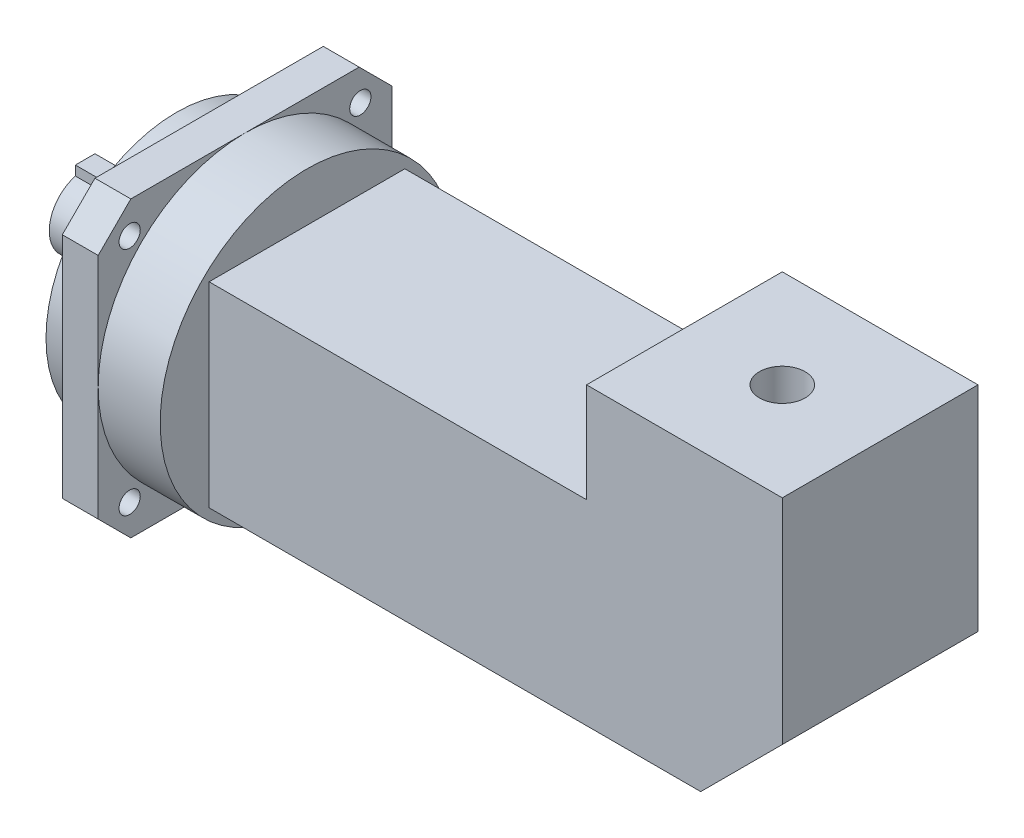
from build123d import *

# Parameters (mm, degrees)
BOSS_EXTRUDE1_DEPTH      = 10
BOSS_EXTRUDE1_DEPTH_BACK = 38
BOSS_EXTRUDE2_START      = -10
SKETCH1_3_R              = 40
BOSS_EXTRUDE2_DEPTH      = 10
SKETCH1_4_R              = 45
SKETCH1_4_R_2            = 11
BOSS_EXTRUDE3_DEPTH      = 9
SKETCH2_R                = 45
SKETCH2_W                = 60
SKETCH2_H                = 60
BOSS_EXTRUDE4_DEPTH      = 30
SKETCH2_3_W              = 60
SKETCH2_3_H              = 60
BOSS_EXTRUDE5_DEPTH      = 205.7
SKETCH3_W                = 60
SKETCH3_H                = 60
SKETCH3_R                = 7
BOSS_EXTRUDE6_DEPTH      = 60.5
CHAMFER1_SIZE            = 25
BOSS_EXTRUDE7_DEPTH      = 11
SKETCH7_R                = 3.25
CUT_EXTRUDE2_DEPTH       = 51


with BuildPart() as part:
    # Sketch1 → Boss-Extrude1 (new, two sides: drawn at the far end of the back side and taken through both)
    with BuildSketch(Plane(origin=(0, 0, 0), x_dir=(0, 0, -1), z_dir=(1, 0, 0)).offset(-BOSS_EXTRUDE1_DEPTH_BACK)):
        with BuildLine():
            Line((3, 10.583005244), (3, 13.5))
            Line((3, 13.5), (-3, 13.5))
            Line((-3, 13.5), (-3, 10.583005244))
            ThreePointArc((-3, 10.583005244), (0, -11), (3, 10.583005244))
        make_face()
    extrude(amount=BOSS_EXTRUDE1_DEPTH + BOSS_EXTRUDE1_DEPTH_BACK)

    # Sketch1<3> → Boss-Extrude2 (add)
    with BuildSketch(Plane(origin=(0, 0, 0), x_dir=(0, 0, -1), z_dir=(1, 0, 0)).offset(BOSS_EXTRUDE2_START)):
        Circle(SKETCH1_3_R)
        with BuildLine():
            Line((-3, 13.5), (3, 13.5))
            Line((3, 13.5), (3, 10.583005244))
            ThreePointArc((3, 10.583005244), (8.774964387, 6.633249581), (11, 0))
            ThreePointArc((11, 0), (-6.633249581, -8.774964387), (-3, 10.583005244))
            Line((-3, 10.583005244), (-3, 13.5))
        make_face(mode=Mode.SUBTRACT)
    extrude(amount=BOSS_EXTRUDE2_DEPTH)



with BuildPart() as body_2:
    # Sketch1<4> → Boss-Extrude3 (new body)
    with BuildSketch(Plane(origin=(0, 0, 0), x_dir=(0, 0, -1), z_dir=(1, 0, 0))):
        Circle(SKETCH1_4_R)
        Circle(SKETCH1_4_R_2, mode=Mode.SUBTRACT)
    extrude(amount=BOSS_EXTRUDE3_DEPTH)


with BuildPart() as part_1:
    add(part.part)

    add(body_2.part)  # Boss-Extrude4 merges body 2
    # Sketch2 → Boss-Extrude4 (add)
    with BuildSketch(Plane(origin=(0, 0, 0), x_dir=(0, 0, -1), z_dir=(1, 0, 0))):
        Circle(SKETCH2_R)
        Rectangle(SKETCH2_W, SKETCH2_H, mode=Mode.SUBTRACT)
    extrude(amount=BOSS_EXTRUDE4_DEPTH)

    # Sketch2<3> → Boss-Extrude5 (add)
    with BuildSketch(Plane(origin=(0, 0, 0), x_dir=(0, 0, -1), z_dir=(1, 0, 0))):
        Rectangle(SKETCH2_3_W, SKETCH2_3_H)
    extrude(amount=BOSS_EXTRUDE5_DEPTH)

    # Sketch3 → Boss-Extrude6 (add)
    with BuildSketch(Plane(origin=(0, 0, 0), x_dir=(1, 0, 0), z_dir=(0, 1, 0))):
        with Locations((175.7, 0)):
            Rectangle(SKETCH3_W, SKETCH3_H)
        with Locations((175.7, 0)):
            Circle(SKETCH3_R, mode=Mode.SUBTRACT)
    extrude(amount=BOSS_EXTRUDE6_DEPTH)

    # Chamfer1
    chamfer1_edges = [part_1.edges().sort_by_distance(p)[0] for p in [
        (205.7, -30, 0),
    ]]
    chamfer(chamfer1_edges, length=CHAMFER1_SIZE)

    # Sketch6 → Boss-Extrude7 (add)
    with BuildSketch(Plane(origin=(0, 0, 0), x_dir=(0, 0, -1), z_dir=(1, 0, 0))):
        Polygon((45, 35), (35, 45), (-35, 45), (-45, 35), (-45, -35), (-35, -45), (35, -45), (45, -35), align=None)
    extrude(amount=BOSS_EXTRUDE7_DEPTH)

    # Sketch7 → Cut-Extrude2 (cut)
    with BuildSketch(Plane(origin=(0, 0, 0), x_dir=(0, 0, -1), z_dir=(1, 0, 0))):
        with Locations((35.355339059, 35.355339059)):
            Circle(SKETCH7_R)
        with Locations((35.355339059, -35.355339059)):
            Circle(SKETCH7_R)
        with Locations((-35.355339059, 35.355339059)):
            Circle(SKETCH7_R)
        with Locations((-35.355339059, -35.355339059)):
            Circle(SKETCH7_R)
    extrude(amount=CUT_EXTRUDE2_DEPTH, mode=Mode.SUBTRACT)


solid = part_1.part
